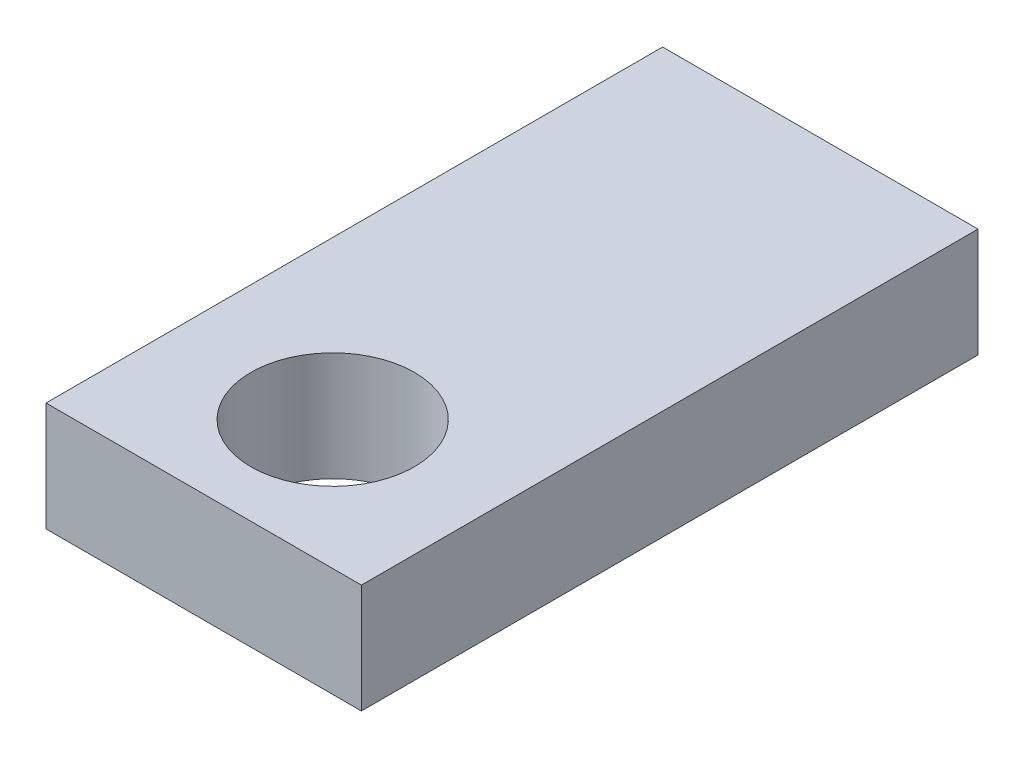
from build123d import *

# Parameters (mm, degrees)
BOSS_EXTRUDE1_DEPTH = 8
SKETCH2_W           = 23.137445614
SKETCH2_H           = 10.306738945
BOSS_EXTRUDE2_DEPTH = 8


with BuildPart() as part:
    # Sketch1 → Boss-Extrude1 (new body)
    with BuildSketch(Plane(origin=(0, 0, 0), x_dir=(1, 0, 0), z_dir=(0, 1, 0))):
        with BuildLine():
            Line((11.568722807, -17.464704369), (11.568722807, 17.464704369))
            Line((11.568722807, 17.464704369), (0, 17.464704369))
            Line((0, 17.464704369), (0, -2.002357687))
            ThreePointArc((0, -2.002357687), (4.242640687, -3.759717), (6, -8.002357687))
            ThreePointArc((6, -8.002357687), (4.242640687, -12.244998375), (0, -14.002357687))
            Line((0, -14.002357687), (0, -17.464704369))
            Line((0, -17.464704369), (11.568722807, -17.464704369))
        make_face()
        with BuildLine():
            Line((0, -2.002357687), (0, 17.464704369))
            Line((0, 17.464704369), (-11.568722807, 17.464704369))
            Line((-11.568722807, 17.464704369), (-11.568722807, -17.464704369))
            Line((-11.568722807, -17.464704369), (0, -17.464704369))
            Line((0, -17.464704369), (0, -14.002357687))
            ThreePointArc((0, -14.002357687), (-6, -8.002357687), (0, -2.002357687))
        make_face()
    extrude(amount=BOSS_EXTRUDE1_DEPTH)

    # Sketch2 → Boss-Extrude2 (add)
    with BuildSketch(Plane.XZ):
        with Locations((0, -22.618073841)):
            Rectangle(SKETCH2_W, SKETCH2_H)
    extrude(amount=-BOSS_EXTRUDE2_DEPTH)


solid = part.part
